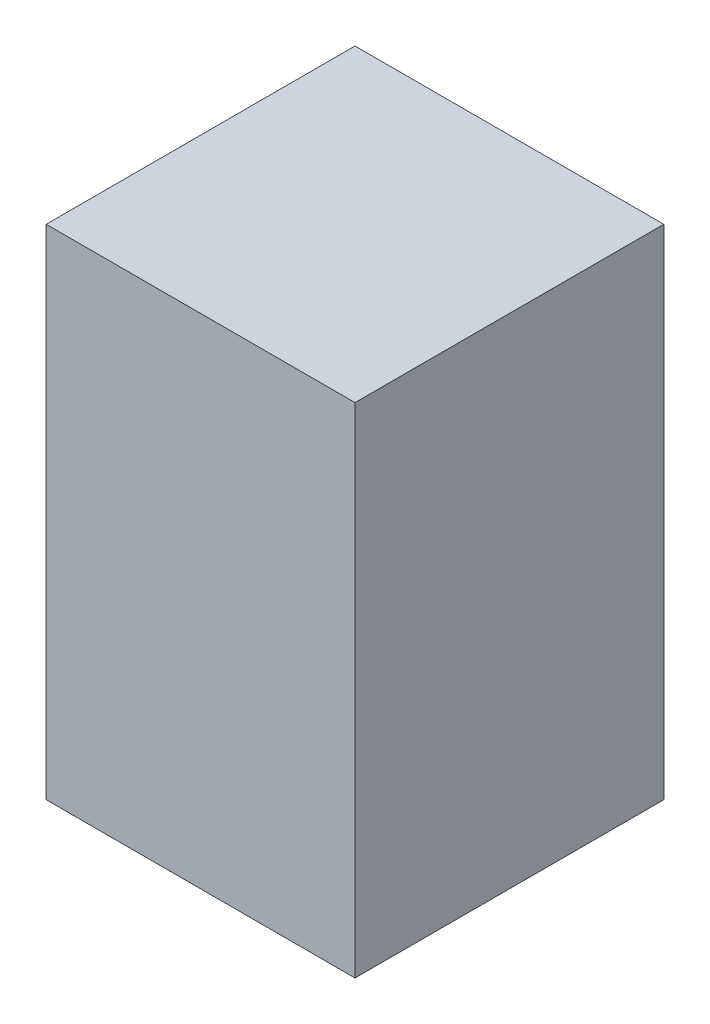
from build123d import *

# Parameters (mm, degrees)
SKETCH1_W           = 42.2
SKETCH1_H           = 42.2
BOSS_EXTRUDE1_DEPTH = 68.1
SKETCH2_R           = 11
BOSS_EXTRUDE2_DEPTH = 1.8


with BuildPart() as part:
    # Sketch1 → Boss-Extrude1 (new body)
    with BuildSketch(Plane(origin=(0, 0, 0), x_dir=(1, 0, 0), z_dir=(0, 1, 0))):
        Rectangle(SKETCH1_W, SKETCH1_H)
    extrude(amount=BOSS_EXTRUDE1_DEPTH)

    # Sketch2 → Boss-Extrude2 (add)
    with BuildSketch(Plane.XZ):
        with Locations(Location((0, 0, 0), (0, 0, 270))):
            Circle(SKETCH2_R)
    extrude(amount=BOSS_EXTRUDE2_DEPTH)


solid = part.part
